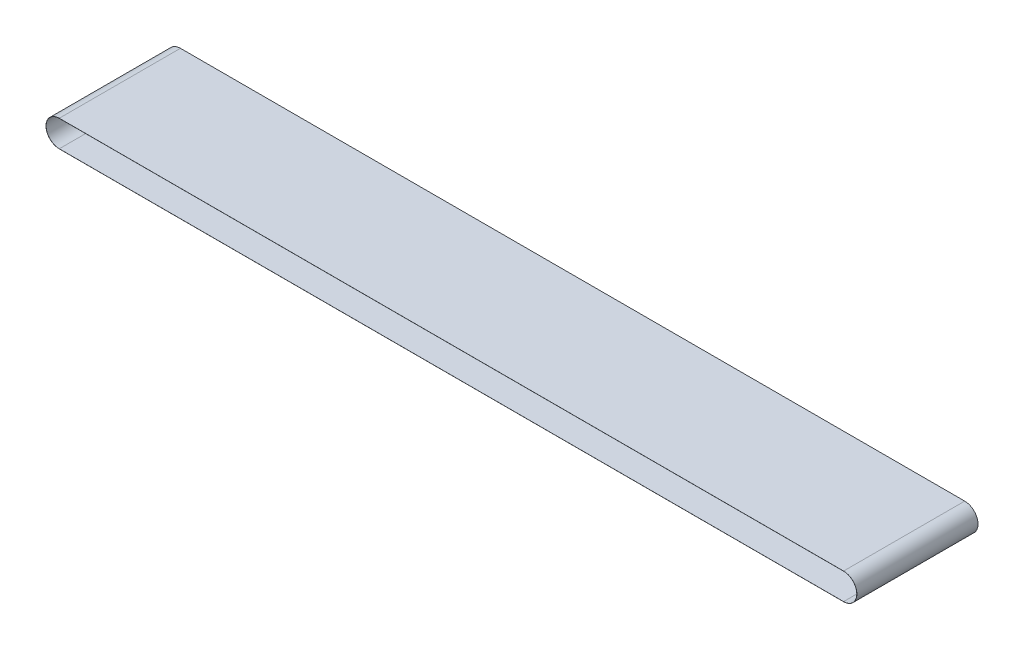
from build123d import *

# Parameters (mm, degrees)
BOSS_EXTRUDE1_DEPTH = 762.5


with BuildPart() as part:
    # Sketch1 → Boss-Extrude1 (new, symmetric)
    with BuildSketch(Plane.XY):
        with BuildLine():
            Line((0, -167.2), (9873.28, -167.2))
            ThreePointArc((9873.28, -167.2), (10040.48, 0), (9873.28, 167.2))
            Line((9873.28, 167.2), (0, 167.2))
            ThreePointArc((0, 167.2), (-167.2, 0), (0, -167.2))
        make_face()
        with BuildLine():
            Line((0, 166), (9873.28, 166))
            ThreePointArc((9873.28, 166), (10039.28, 0), (9873.28, -166))
            Line((9873.28, -166), (0, -166))
            ThreePointArc((0, -166), (-166, 0), (0, 166))
        make_face(mode=Mode.SUBTRACT)
    extrude(amount=BOSS_EXTRUDE1_DEPTH, both=True)


solid = part.part
